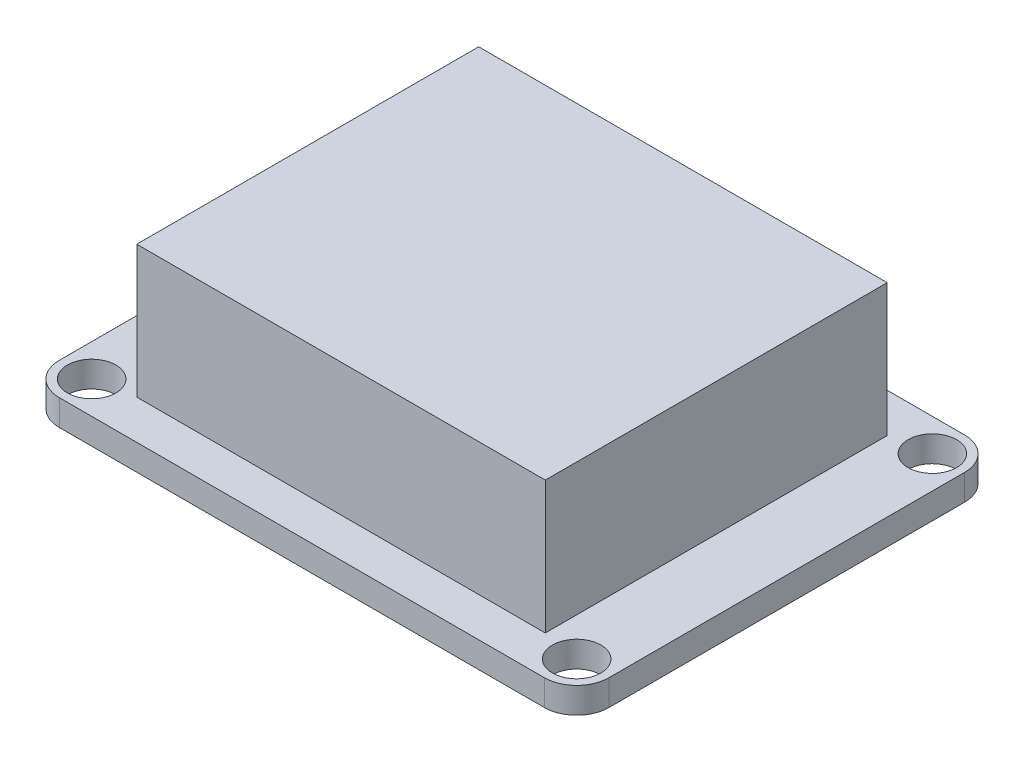
from build123d import *

# Parameters (mm, degrees)
SKETCH1_W               = 34
SKETCH1_H               = 26
BOSS_EXTRUDE1_DEPTH     = 1.6
FILLET1_R               = 2
SKETCH4_W               = 25.27
SKETCH4_H               = 21.15
BOSS_EXTRUDE3_DEPTH     = 8.19
CUT_EXTRUDE1_DEPTH      = 23.914539053
CUT_EXTRUDE1_DEPTH_BACK = 23.914539053
SKETCH5_R               = 1.5


with BuildPart() as part:
    # Sketch1 → Boss-Extrude1 (new body)
    with BuildSketch(Plane(origin=(0, 0, 0), x_dir=(1, 0, 0), z_dir=(0, 1, 0))):
        Rectangle(SKETCH1_W, SKETCH1_H)
    extrude(amount=BOSS_EXTRUDE1_DEPTH)

    # Fillet1
    fillet1_edges = [part.edges().sort_by_distance(p)[0] for p in [
        (-17, 0.8, -13),
        (17, 0.8, -13),
        (17, 0.8, 13),
        (-17, 0.8, 13),
    ]]
    fillet(fillet1_edges, radius=FILLET1_R)

    # Sketch4 → Boss-Extrude3 (add)
    with BuildSketch(Plane(origin=(0, 1.6, 0), x_dir=(1, 0, 0), z_dir=(0, 1, 0))):
        Rectangle(SKETCH4_W, SKETCH4_H)
    extrude(amount=BOSS_EXTRUDE3_DEPTH)

    # Sketch5 → Cut-Extrude1 (cut, two sides: drawn at the far end of the back side and taken through both)
    with BuildSketch(Plane(origin=(0, 1.6, 0), x_dir=(1, 0, 0), z_dir=(0, 1, 0)).offset(-CUT_EXTRUDE1_DEPTH_BACK)):
        with Locations(Location((15, 11, 0), (0, 0, 270))):
            Circle(SKETCH5_R)
        with Locations(Location((15, -11, 0), (0, 0, 270))):
            Circle(SKETCH5_R)
        with Locations(Location((-15, -11, 0), (0, 0, 270))):
            Circle(SKETCH5_R)
        with Locations(Location((-15, 11, 0), (0, 0, 270))):
            Circle(SKETCH5_R)
    extrude(amount=CUT_EXTRUDE1_DEPTH + CUT_EXTRUDE1_DEPTH_BACK, mode=Mode.SUBTRACT)


solid = part.part
